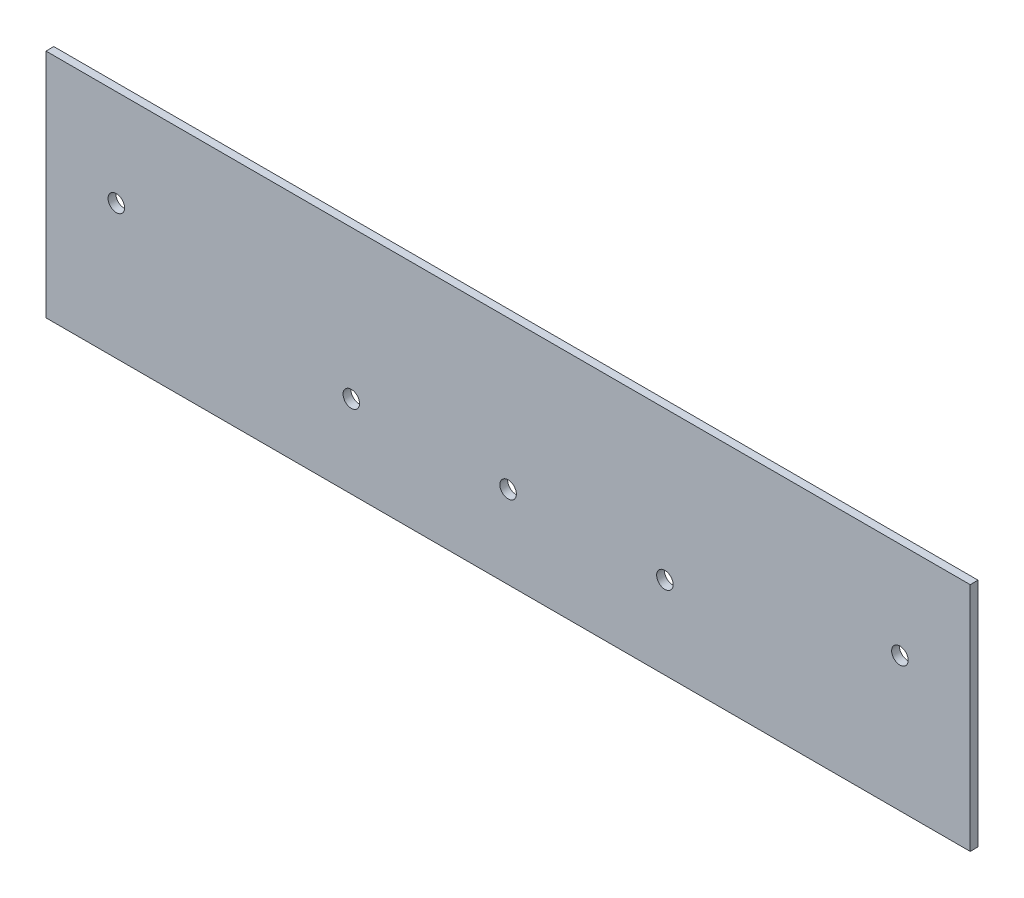
from build123d import *

# Parameters (mm, degrees)
SKETCH1_W           = 355.6
SKETCH1_H           = 114.3
BOSS_EXTRUDE1_DEPTH = 3
SKETCH3_R           = 3.175
CUT_EXTRUDE1_DEPTH  = 3
CUT_EXTRUDE2_REACH  = 188.783
SKETCH4_W           = 355.6
SKETCH4_H           = 25.4


with BuildPart() as part:
    # Sketch1 → Boss-Extrude1 (new body)
    with BuildSketch(Plane.XY):
        Rectangle(SKETCH1_W, SKETCH1_H)
    extrude(amount=BOSS_EXTRUDE1_DEPTH)

    # Sketch3 → Cut-Extrude1 (cut)
    with BuildSketch(Plane.XY.offset(3)):
        with Locations((-60.325, 0)):
            Circle(SKETCH3_R)
        Circle(SKETCH3_R)
        with Locations((-150.749, 20)):
            Circle(SKETCH3_R)
    cut_extrude1 = extrude(amount=-CUT_EXTRUDE1_DEPTH, mode=Mode.SUBTRACT)

    # Mirror3: Cut-Extrude1 across plane
    add(cut_extrude1.mirror(Plane(origin=(0, 0, 0), x_dir=(0, 0, 1), z_dir=(1, 0, 0))), mode=Mode.SUBTRACT)

    # Sketch4 → Cut-Extrude2 (cut, up to next)
    with BuildSketch(Plane(origin=(0, 0, 0), x_dir=(-1, 0, 0), z_dir=(0, 0, -1)), mode=Mode.PRIVATE) as cut_extrude2_sk1:
        with Locations((0, -44.45)):
            Rectangle(SKETCH4_W, SKETCH4_H)
    cut_extrude2_tool1 = extrude(cut_extrude2_sk1.sketch, amount=-CUT_EXTRUDE2_REACH, mode=Mode.PRIVATE) & part.part
    add(cut_extrude2_tool1.solids().sort_by_distance((0, -44.45, 0))[0], mode=Mode.SUBTRACT)


solid = part.part
